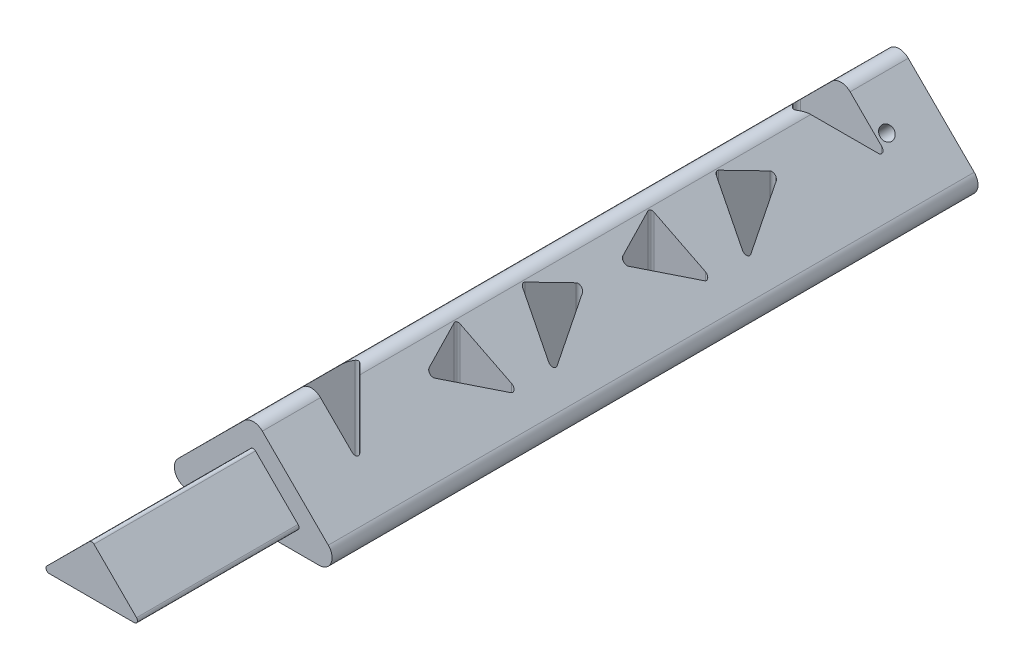
from build123d import *

# Parameters (mm, degrees)
EXTRUDE_1_DEPTH     = 100
FILLET_1_R          = 4
EXTRUDE_2_DEPTH     = 50
FILLET_2_R          = 1
CUT_EXTRUDE_1_DEPTH = 155.597772267
FILLET_3_R          = 1
CUT_EXTRUDE_2_REACH = 157.823
SKETCH_4_R          = 2.099999206


with BuildPart() as part:
    # 草图1 → 凸台-拉伸1 (new, symmetric)
    with BuildSketch(Plane.XY):
        Polygon((-30.1, 0), (30.1, 0), (0, 30.003999733), align=None)
    extrude(amount=EXTRUDE_1_DEPTH, both=True)

    # 圆角1
    fillet_1_edges = [part.edges().sort_by_distance(p)[0] for p in [
        (0, 30.003999733, 0),
        (30.1, 0, 0),
        (-30.1, 0, 0),
    ]]
    fillet(fillet_1_edges, radius=FILLET_1_R)

    # 草图2 → 凸台-拉伸2 (add)
    with BuildSketch(Plane.XY.offset(100)):
        Polygon((15.581935613, 6), (0, 21.532238936), (-15.581935613, 6), align=None)
    extrude(amount=EXTRUDE_2_DEPTH)

    # 圆角2
    fillet_2_edges = [part.edges().sort_by_distance(p)[0] for p in [
        (-15.581935613, 6, 125),
        (15.581935613, 6, 125),
        (0, 21.532238936, 125),
    ]]
    fillet(fillet_2_edges, radius=FILLET_2_R)

    # 草图3 → 切除-拉伸1 (cut, through all)
    with BuildSketch(Plane(origin=(0, 0, 0), x_dir=(1, 0, 0), z_dir=(0, 1, 0))):
        Polygon((-15, 82), (0, 67), (15, 82), align=None)
        Polygon((-8, 55), (-18, 35), (-2.823905857, 40), align=None)
        Polygon((2.823905857, 40), (8, 55), (18, 35), align=None)
        Polygon((8, 5), (18, 25), (2.823905857, 20), align=None)
        Polygon((-2.823905857, 20), (-8, 5), (-18, 25), align=None)
        Polygon((-8, -5), (-18, -25), (-2.823905857, -20), align=None)
        Polygon((2.823905857, -20), (8, -5), (18, -25), align=None)
        Polygon((8, -55), (18, -35), (2.823905857, -40), align=None)
        Polygon((-2.823905857, -40), (-8, -55), (-18, -35), align=None)
        Polygon((15, -82), (0, -67), (-15, -82), align=None)
    extrude(amount=CUT_EXTRUDE_1_DEPTH, mode=Mode.SUBTRACT)

    # 圆角3
    fillet_3_edges = [part.edges().sort_by_distance(p)[0] for p in [
        (0, 14.178079601, -67),
        (-15, 7.525920199, -82),
        (2.823905857, 13.594550189, -40),
        (8, 11.014757377, -55),
        (18, 6.030704265, -35),
        (-2.823905857, 13.594550189, -20),
        (-8, 11.014757377, -5),
        (-18, 6.030704265, -25),
        (2.823905857, 13.594550189, 20),
        (8, 11.014757377, 5),
        (18, 6.030704265, 25),
        (-2.823905857, 13.594550189, 40),
        (-8, 11.014757377, 55),
        (-18, 6.030704265, 35),
        (-15, 7.525920199, 82),
        (0, 14.178079601, 67),
        (15, 7.525920199, 82),
        (2.823905857, 13.594550189, 40),
        (18, 6.030704265, 35),
        (8, 11.014757377, 55),
        (-2.823905857, 13.594550189, 20),
        (-18, 6.030704265, 25),
        (-8, 11.014757377, 5),
        (2.823905857, 13.594550189, -20),
        (18, 6.030704265, -25),
        (8, 11.014757377, -5),
        (-2.823905857, 13.594550189, -40),
        (-18, 6.030704265, -35),
        (-8, 11.014757377, -55),
        (15, 7.525920199, -82),
    ]]
    fillet(fillet_3_edges, radius=FILLET_3_R)

    # 草图4 → 切除-拉伸2 (cut, up to next)
    with BuildSketch(Plane(origin=(-15.001923322, 15.04992321, 0), x_dir=(0.7082352941176472, 0.705976464314562, 0), z_dir=(-0.705976464314562, 0.7082352941176472, 0)), mode=Mode.PRIVATE) as cut_extrude_2_sk1:
        with Locations(Location((5.355142644, 85, 0), (0, 0, 180))):
            Circle(SKETCH_4_R)
    cut_extrude_2_tool1 = extrude(cut_extrude_2_sk1.sketch, amount=-CUT_EXTRUDE_2_REACH, mode=Mode.PRIVATE) & part.part
    cut_extrude_2 = cut_extrude_2_tool1.solids().sort_by_distance((-11.209222, 18.830528, -85))[0]
    add(cut_extrude_2, mode=Mode.SUBTRACT)

    # 镜向1: 切除-拉伸2 mirrored; each copy of 切除-拉伸2 runs up to whatever stops it at its own place
    mirror_1_before = part.part  # the part as the pattern finds it: every copy runs up to it
    mirror_1_cut_extrude_2_long = extrude(cut_extrude_2_sk1.sketch, amount=-CUT_EXTRUDE_2_REACH, mode=Mode.PRIVATE)
    mirror_1_cut_extrude_2_tool1 = mirror_1_cut_extrude_2_long.mirror(Plane(origin=(0, 0, 0), x_dir=(0, 0, 1), z_dir=(1, 0, 0))) & mirror_1_before
    add(mirror_1_cut_extrude_2_tool1.solids().sort_by_distance((11.209222, 18.830528, -85))[0], mode=Mode.SUBTRACT)


solid = part.part
